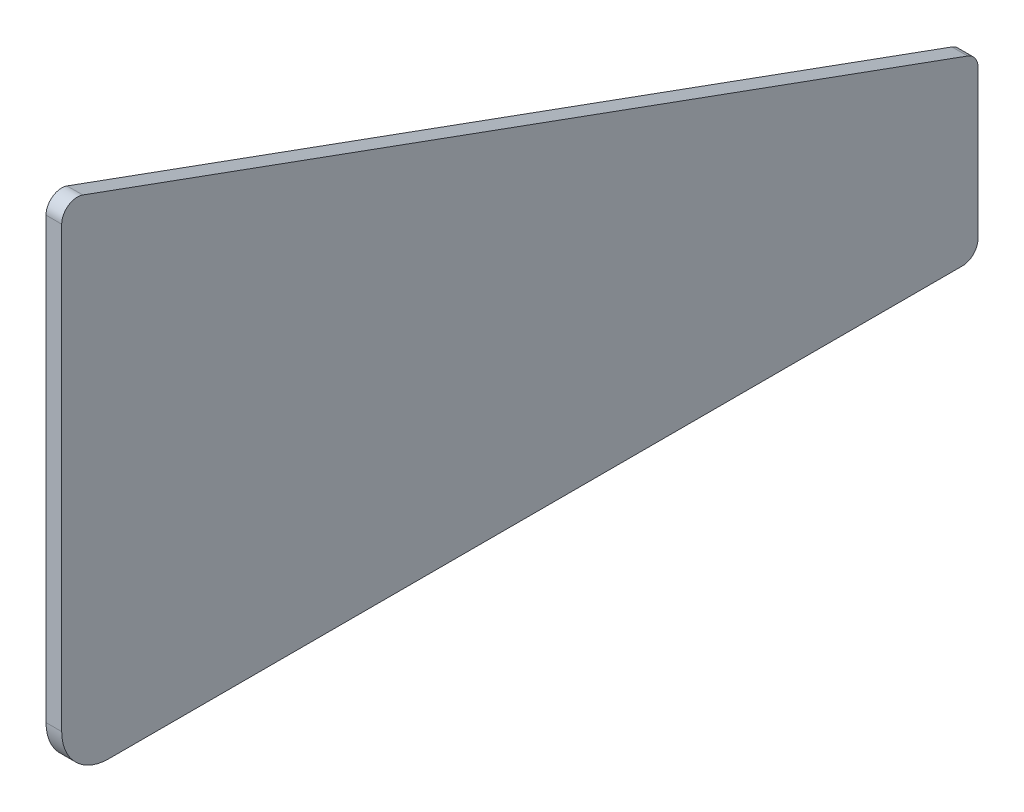
from build123d import *

# Parameters (mm, degrees)
BOSS_EXTRUDE1_DEPTH = 10
CUT_EXTRUDE3_DEPTH  = 3


with BuildPart() as part:
    # Sketch1 → Boss-Extrude1 (new body)
    with BuildSketch(Plane(origin=(0, 0, 0), x_dir=(0, 0, -1), z_dir=(1, 0, 0))):
        with BuildLine():
            Line((0, -14.281480067), (0, -294.281480067))
            ThreePointArc((0, -294.281480067), (8.786796564, -315.494683503), (30, -324.281480067))
            Line((30, -324.281480067), (573.815572472, -324.281480067))
            ThreePointArc((573.815572472, -324.281480067), (580.886640283, -321.352547879), (583.815572472, -314.281480067))
            Line((583.815572472, -314.281480067), (583.815572472, -219.493566063))
            ThreePointArc((583.815572472, -219.493566063), (582.007092914, -213.757801699), (577.235773905, -210.096639855))
            Line((577.235773905, -210.096639855), (13.420201433, -4.88455386))
            ThreePointArc((13.420201433, -4.88455386), (4.264235636, -6.089959625), (0, -14.281480067))
        make_face()
    extrude(amount=BOSS_EXTRUDE1_DEPTH)

    # Sketch3 → Cut-Extrude3 (cut)
    with BuildSketch(Plane.ZY):
        with BuildLine():
            ThreePointArc((-23.162175785, -218.017297737), (-17.576945532, -207.678107035), (-26.738120061, -200.318314743))
            add(Edge.make_bspline(
                [(-26.738120061, -200.318314743), (-45.914354434, -200.660753587), (-151.32107334, -255.510398156), (-414.880335601, -286.385074175), (-542.431128002, -257.731725159), (-546.154906269, -257.731029979)],
                knots=[0, 0, 0, 0, 0.560935224, 0.660935224, 1, 1, 1, 1], degree=3))
            ThreePointArc((-546.154906269, -257.731029979), (-563.288388976, -273.27487263), (-549.474047026, -291.831036849))
            add(Edge.make_bspline(
                [(-549.474047026, -291.831036849), (-474.750080899, -306.502271197), (-284.669923623, -324.572171749), (-143.080818041, -266.034178467), (-23.162175785, -218.017297737)],
                knots=[0, 0, 0, 0, 0.423888314, 1, 1, 1, 1], degree=3))
        make_face()
        with BuildLine():
            ThreePointArc((-26.950185671, -47.737214996), (-28.17113687, -40.715672082), (-35.124917897, -39.154353359))
            add(Edge.make_bspline(
                [(-35.124917897, -39.154353359), (-50.602952828, -45.122445935), (-99.042539, -170.661871263), (-331.224003862, -171.181746235), (-353.169530365, -171.181734297)],
                knots=[0, 0, 0, 0, 0.639195597, 1, 1, 1, 1], degree=3))
            ThreePointArc((-353.169530365, -171.181734297), (-370.309371751, -186.812434708), (-356.32010769, -205.316311305))
            add(Edge.make_bspline(
                [(-356.32010769, -205.316311305), (-352.838937223, -205.964445921), (-121.396454164, -217.989087479), (-35.312726243, -66.629555086), (-26.950185671, -47.737214996)],
                knots=[0, 0, 0, 0, 0.40968467, 1, 1, 1, 1], degree=3))
        make_face()
    extrude(amount=-CUT_EXTRUDE3_DEPTH, mode=Mode.SUBTRACT)


solid = part.part
